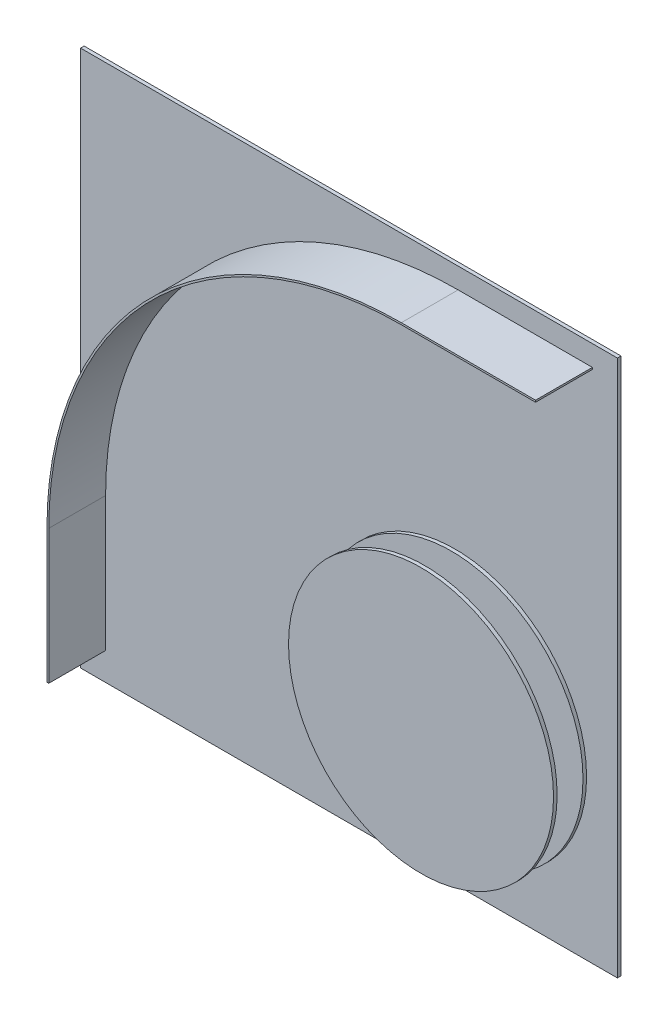
from build123d import *

# Parameters (mm, degrees)
SKETCH1_R                = 147
BOSS_EXTRUDE1_DEPTH      = 4
EXTRUDE_THIN1_DEPTH      = 60
EXTRUDE_THIN1_DEPTH_BACK = 5.5
SKETCH2_R                = 148.070981451
BOSS_EXTRUDE2_DEPTH      = 4
SKETCH3_R                = 15
BOSS_EXTRUDE3_DEPTH      = 30
SKETCH5_W                = 600
SKETCH5_H                = 600
BOSS_EXTRUDE5_DEPTH      = 4


with BuildPart() as part:
    # Sketch1 → Boss-Extrude1 (new body)
    with BuildSketch(Plane.XY):
        Circle(SKETCH1_R)
    extrude(amount=BOSS_EXTRUDE1_DEPTH)

    # Sketch3 → Boss-Extrude3 (add)
    with BuildSketch(Plane.XY.offset(4)):
        with Locations((0, 84.546251692)):
            Circle(SKETCH3_R)
        with Locations((84.546251692, 0)):
            Circle(SKETCH3_R)
        with Locations((0, -84.546251692)):
            Circle(SKETCH3_R)
        with Locations((-84.546251692, 0)):
            Circle(SKETCH3_R)
    extrude(amount=BOSS_EXTRUDE3_DEPTH)


with BuildPart() as body_2:
    # Sketch1<4> → Extrude-Thin1 (new, two sides: drawn at the far end of the back side and taken through both)
    with BuildSketch(Plane.XY.offset(-EXTRUDE_THIN1_DEPTH_BACK)):
        with BuildLine():
            Line((150, 394), (0, 394))
            ThreePointArc((0, 394), (-278.600071787, 278.600071787), (-394, 0))
            Line((-394, 0), (-394, -150))
            Line((-394, -150), (-396, -150))
            Line((-396, -150), (-396, 0))
            ThreePointArc((-396, 0), (-280.01428535, 280.01428535), (0, 396))
            Line((0, 396), (150, 396))
            Line((150, 396), (150, 394))
        make_face()
    extrude(amount=EXTRUDE_THIN1_DEPTH + EXTRUDE_THIN1_DEPTH_BACK)


with BuildPart() as body_3:
    # Sketch2 → Boss-Extrude2 (new body)
    with BuildSketch(Plane.XY.offset(34)):
        Circle(SKETCH2_R)
    extrude(amount=BOSS_EXTRUDE2_DEPTH)


with BuildPart() as body_4:
    # Sketch5 → Boss-Extrude5 (new body)
    with BuildSketch(Plane.XY.offset(-3.5)):
        with Locations((-122.012002147, 119.033794954)):
            Rectangle(SKETCH5_W, SKETCH5_H)
    extrude(amount=-BOSS_EXTRUDE5_DEPTH)


solid = Compound([part.part, body_2.part, body_3.part, body_4.part])
